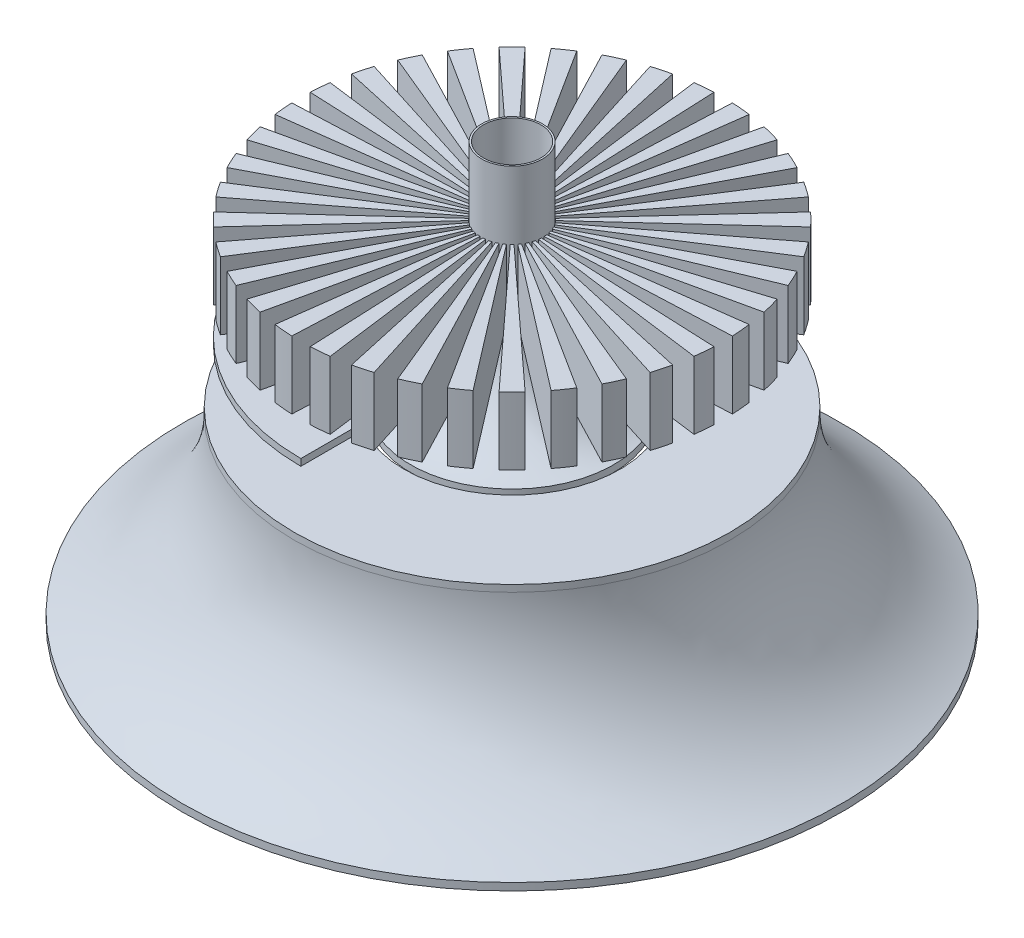
from build123d import *

# Parameters (mm, degrees)
SKETCH_2_R            = 9
SKETCH_2_R_2          = 8.5
EXTRUDE_532_DEPTH     = 40
EXTRUDE_7016_DEPTH    = 20
EXTRUDE_7016_2_DEPTH  = 20
EXTRUDE_7016_3_DEPTH  = 20
EXTRUDE_7016_4_DEPTH  = 20
EXTRUDE_7016_5_DEPTH  = 20
EXTRUDE_7016_6_DEPTH  = 20
EXTRUDE_7016_7_DEPTH  = 20
EXTRUDE_7016_8_DEPTH  = 20
EXTRUDE_7016_9_DEPTH  = 20
EXTRUDE_7016_10_DEPTH = 20
EXTRUDE_7016_11_DEPTH = 20
EXTRUDE_7016_12_DEPTH = 20
EXTRUDE_7016_13_DEPTH = 20
EXTRUDE_7016_14_DEPTH = 20
EXTRUDE_7016_15_DEPTH = 20
EXTRUDE_7016_16_DEPTH = 20
EXTRUDE_7016_17_DEPTH = 20
EXTRUDE_7016_18_DEPTH = 20
EXTRUDE_7016_19_DEPTH = 20
EXTRUDE_7016_20_DEPTH = 20
EXTRUDE_7016_21_DEPTH = 20
EXTRUDE_7016_22_DEPTH = 20
EXTRUDE_7016_23_DEPTH = 20
EXTRUDE_7016_24_DEPTH = 20
EXTRUDE_7016_25_DEPTH = 20
EXTRUDE_7016_26_DEPTH = 20
EXTRUDE_7016_27_DEPTH = 20
EXTRUDE_7016_28_DEPTH = 20
EXTRUDE_7016_29_DEPTH = 20
EXTRUDE_7016_30_DEPTH = 20
EXTRUDE_7016_31_DEPTH = 20
EXTRUDE_7016_32_DEPTH = 20
EXTRUDE_7016_33_DEPTH = 20
EXTRUDE_7016_34_DEPTH = 20
EXTRUDE_7016_35_DEPTH = 20
EXTRUDE_7016_36_DEPTH = 20
EXTRUDE_START         = -10
EXTRUDE_6_DEPTH       = 2
SKETCH_14_R           = 8.5
EXTRUDE_1_DEPTH       = 2
LED_START             = -30
SKETCH_17_R           = 62.5
SKETCH_17_R_2         = 32
LED_DEPTH             = 2
EXTRUDE_START_2       = -30
SKETCH_19_R           = 5
EXTRUDE_5_DEPTH       = 2


with BuildPart() as part:
    # 草图2 → Extrude 532 (new body)
    with BuildSketch(Plane(origin=(0, 0, 0), x_dir=(1, 0, 0), z_dir=(0, 1, 0))):
        Circle(SKETCH_2_R)
        Circle(SKETCH_2_R_2, mode=Mode.SUBTRACT)
    extrude(amount=EXTRUDE_532_DEPTH)



with BuildPart() as body_2:
    # 草图6 → Extrude 7016 (new body)
    with BuildSketch(Plane(origin=(0, 0, 0), x_dir=(1, 0, 0), z_dir=(0, 1, 0))):
        with BuildLine():
            ThreePointArc((-0.396611349, -9.083893359), (-0.792467726, -9.057947562), (-1.186815596, -9.014759446))
            Line((-1.186815596, -9.014759446), (-8.157887014, -61.965303836))
            ThreePointArc((-8.157887014, -61.965303836), (-5.447233922, -62.262168631), (-2.72621171, -62.440513849))
            Line((-2.72621171, -62.440513849), (-0.396611349, -9.083893359))
        make_face()
    extrude(amount=EXTRUDE_7016_DEPTH)


with BuildPart() as body_3:
    # 草图6 → Extrude 7016 2 (new body)
    with BuildSketch(Plane(origin=(0, 0, 0), x_dir=(1, 0, 0), z_dir=(0, 1, 0))):
        with BuildLine():
            ThreePointArc((0.396611349, 9.083893359), (0.792467726, 9.057947562), (1.186815596, 9.014759446))
            Line((1.186815596, 9.014759446), (8.157887014, 61.965303836))
            ThreePointArc((8.157887014, 61.965303836), (5.447233922, 62.262168631), (2.72621171, 62.440513849))
            Line((2.72621171, 62.440513849), (0.396611349, 9.083893359))
        make_face()
    extrude(amount=EXTRUDE_7016_2_DEPTH)


with BuildPart() as body_4:
    # 草图6 → Extrude 7016 3 (new body)
    with BuildSketch(Plane(origin=(0, 0, 0), x_dir=(1, 0, 0), z_dir=(0, 1, 0))):
        with BuildLine():
            Line((13.527475871, 61.018500445), (1.96798746, 8.87701777))
            ThreePointArc((1.96798746, 8.87701777), (2.353324449, 8.782726409), (2.73418175, 8.671716628))
            Line((2.73418175, 8.671716628), (18.794112469, 59.607309422))
            ThreePointArc((18.794112469, 59.607309422), (16.176190319, 60.370364143), (13.527475871, 61.018500445))
        make_face()
    extrude(amount=EXTRUDE_7016_3_DEPTH)


with BuildPart() as body_5:
    # 草图6 → Extrude 7016 4 (new body)
    with BuildSketch(Plane(origin=(0, 0, 0), x_dir=(1, 0, 0), z_dir=(0, 1, 0))):
        with BuildLine():
            Line((23.917714523, 57.742470782), (3.479567267, 8.400418487))
            ThreePointArc((3.479567267, 8.400418487), (3.842676598, 8.240646558), (4.198471176, 8.065188089))
            Line((4.198471176, 8.065188089), (28.859288327, 55.438177074))
            ThreePointArc((28.859288327, 55.438177074), (26.413641359, 56.64423669), (23.917714523, 57.742470782))
        make_face()
    extrude(amount=EXTRUDE_7016_4_DEPTH)


with BuildPart() as body_6:
    # 草图6 → Extrude 7016 5 (new body)
    with BuildSketch(Plane(origin=(0, 0, 0), x_dir=(1, 0, 0), z_dir=(0, 1, 0))):
        with BuildLine():
            Line((33.581225522, 52.711965363), (4.885422184, 7.66857674))
            ThreePointArc((4.885422184, 7.66857674), (5.215270964, 7.448178831), (5.535192179, 7.213602891))
            Line((5.535192179, 7.213602891), (38.047589313, 49.584583768))
            ThreePointArc((38.047589313, 49.584583768), (35.848527272, 51.197002768), (33.581225522, 52.711965363))
        make_face()
    extrude(amount=EXTRUDE_7016_5_DEPTH)


with BuildPart() as body_7:
    # 草图6 → Extrude 7016 6 (new body)
    with BuildSketch(Plane(origin=(0, 0, 0), x_dir=(1, 0, 0), z_dir=(0, 1, 0))):
        with BuildLine():
            Line((59.607309422, 18.794112469), (8.671716628, 2.73418175))
            ThreePointArc((8.671716628, 2.73418175), (8.782726409, 2.353324449), (8.87701777, 1.96798746))
            Line((8.87701777, 1.96798746), (61.018500445, 13.527475871))
            ThreePointArc((61.018500445, 13.527475871), (60.370364143, 16.176190319), (59.607309422, 18.794112469))
        make_face()
    extrude(amount=EXTRUDE_7016_6_DEPTH)


with BuildPart() as body_8:
    # 草图6 → Extrude 7016 7 (new body)
    with BuildSketch(Plane(origin=(0, 0, 0), x_dir=(1, 0, 0), z_dir=(0, 1, 0))):
        with BuildLine():
            Line((42.224387976, 46.079833551), (6.142836019, 6.703729169))
            ThreePointArc((6.142836019, 6.703729169), (6.42940196, 6.42940196), (6.703729169, 6.142836019))
            Line((6.703729169, 6.142836019), (46.079833551, 42.224387976))
            ThreePointArc((46.079833551, 42.224387976), (44.194173824, 44.194173824), (42.224387976, 46.079833551))
        make_face()
    extrude(amount=EXTRUDE_7016_7_DEPTH)


with BuildPart() as body_9:
    # 草图6 → Extrude 7016 8 (new body)
    with BuildSketch(Plane(origin=(0, 0, 0), x_dir=(1, 0, 0), z_dir=(0, 1, 0))):
        with BuildLine():
            Line((49.584583768, 38.047589313), (7.213602891, 5.535192179))
            ThreePointArc((7.213602891, 5.535192179), (7.448178831, 5.215270964), (7.66857674, 4.885422184))
            Line((7.66857674, 4.885422184), (52.711965363, 33.581225522))
            ThreePointArc((52.711965363, 33.581225522), (51.197002768, 35.848527272), (49.584583768, 38.047589313))
        make_face()
    extrude(amount=EXTRUDE_7016_8_DEPTH)


with BuildPart() as body_10:
    # 草图6 → Extrude 7016 9 (new body)
    with BuildSketch(Plane(origin=(0, 0, 0), x_dir=(1, 0, 0), z_dir=(0, 1, 0))):
        with BuildLine():
            Line((55.438177074, 28.859288327), (8.065188089, 4.198471176))
            ThreePointArc((8.065188089, 4.198471176), (8.240646558, 3.842676598), (8.400418487, 3.479567267))
            Line((8.400418487, 3.479567267), (57.742470782, 23.917714523))
            ThreePointArc((57.742470782, 23.917714523), (56.64423669, 26.413641359), (55.438177074, 28.859288327))
        make_face()
    extrude(amount=EXTRUDE_7016_9_DEPTH)


with BuildPart() as body_11:
    # 草图6 → Extrude 7016 10 (new body)
    with BuildSketch(Plane(origin=(0, 0, 0), x_dir=(1, 0, 0), z_dir=(0, 1, 0))):
        with BuildLine():
            Line((61.965303836, 8.157887014), (9.014759446, 1.186815596))
            ThreePointArc((9.014759446, 1.186815596), (9.057947562, 0.792467726), (9.083893359, 0.396611349))
            Line((9.083893359, 0.396611349), (62.440513849, 2.72621171))
            ThreePointArc((62.440513849, 2.72621171), (62.262168631, 5.447233922), (61.965303836, 8.157887014))
        make_face()
    extrude(amount=EXTRUDE_7016_10_DEPTH)


with BuildPart() as body_12:
    # 草图6 → Extrude 7016 11 (new body)
    with BuildSketch(Plane(origin=(0, 0, 0), x_dir=(1, 0, 0), z_dir=(0, 1, 0))):
        with BuildLine():
            Line((-13.527475871, -61.018500445), (-1.96798746, -8.87701777))
            ThreePointArc((-1.96798746, -8.87701777), (-2.353324449, -8.782726409), (-2.73418175, -8.671716628))
            Line((-2.73418175, -8.671716628), (-18.794112469, -59.607309422))
            ThreePointArc((-18.794112469, -59.607309422), (-16.176190319, -60.370364143), (-13.527475871, -61.018500445))
        make_face()
    extrude(amount=EXTRUDE_7016_11_DEPTH)


with BuildPart() as body_13:
    # 草图6 → Extrude 7016 12 (new body)
    with BuildSketch(Plane(origin=(0, 0, 0), x_dir=(1, 0, 0), z_dir=(0, 1, 0))):
        with BuildLine():
            Line((-23.917714523, -57.742470782), (-3.479567267, -8.400418487))
            ThreePointArc((-3.479567267, -8.400418487), (-3.842676598, -8.240646558), (-4.198471176, -8.065188089))
            Line((-4.198471176, -8.065188089), (-28.859288327, -55.438177074))
            ThreePointArc((-28.859288327, -55.438177074), (-26.413641359, -56.64423669), (-23.917714523, -57.742470782))
        make_face()
    extrude(amount=EXTRUDE_7016_12_DEPTH)


with BuildPart() as body_14:
    # 草图6 → Extrude 7016 13 (new body)
    with BuildSketch(Plane(origin=(0, 0, 0), x_dir=(1, 0, 0), z_dir=(0, 1, 0))):
        with BuildLine():
            Line((-33.581225522, -52.711965363), (-4.885422184, -7.66857674))
            ThreePointArc((-4.885422184, -7.66857674), (-5.215270964, -7.448178831), (-5.535192179, -7.213602891))
            Line((-5.535192179, -7.213602891), (-38.047589313, -49.584583768))
            ThreePointArc((-38.047589313, -49.584583768), (-35.848527272, -51.197002768), (-33.581225522, -52.711965363))
        make_face()
    extrude(amount=EXTRUDE_7016_13_DEPTH)


with BuildPart() as body_15:
    # 草图6 → Extrude 7016 14 (new body)
    with BuildSketch(Plane(origin=(0, 0, 0), x_dir=(1, 0, 0), z_dir=(0, 1, 0))):
        with BuildLine():
            Line((-59.607309422, -18.794112469), (-8.671716628, -2.73418175))
            ThreePointArc((-8.671716628, -2.73418175), (-8.782726409, -2.353324449), (-8.87701777, -1.96798746))
            Line((-8.87701777, -1.96798746), (-61.018500445, -13.527475871))
            ThreePointArc((-61.018500445, -13.527475871), (-60.370364143, -16.176190319), (-59.607309422, -18.794112469))
        make_face()
    extrude(amount=EXTRUDE_7016_14_DEPTH)


with BuildPart() as body_16:
    # 草图6 → Extrude 7016 15 (new body)
    with BuildSketch(Plane(origin=(0, 0, 0), x_dir=(1, 0, 0), z_dir=(0, 1, 0))):
        with BuildLine():
            Line((-42.224387976, -46.079833551), (-6.142836019, -6.703729169))
            ThreePointArc((-6.142836019, -6.703729169), (-6.42940196, -6.42940196), (-6.703729169, -6.142836019))
            Line((-6.703729169, -6.142836019), (-46.079833551, -42.224387976))
            ThreePointArc((-46.079833551, -42.224387976), (-44.194173824, -44.194173824), (-42.224387976, -46.079833551))
        make_face()
    extrude(amount=EXTRUDE_7016_15_DEPTH)


with BuildPart() as body_17:
    # 草图6 → Extrude 7016 16 (new body)
    with BuildSketch(Plane(origin=(0, 0, 0), x_dir=(1, 0, 0), z_dir=(0, 1, 0))):
        with BuildLine():
            Line((-49.584583768, -38.047589313), (-7.213602891, -5.535192179))
            ThreePointArc((-7.213602891, -5.535192179), (-7.448178831, -5.215270964), (-7.66857674, -4.885422184))
            Line((-7.66857674, -4.885422184), (-52.711965363, -33.581225522))
            ThreePointArc((-52.711965363, -33.581225522), (-51.197002768, -35.848527272), (-49.584583768, -38.047589313))
        make_face()
    extrude(amount=EXTRUDE_7016_16_DEPTH)


with BuildPart() as body_18:
    # 草图6 → Extrude 7016 17 (new body)
    with BuildSketch(Plane(origin=(0, 0, 0), x_dir=(1, 0, 0), z_dir=(0, 1, 0))):
        with BuildLine():
            Line((-55.438177074, -28.859288327), (-8.065188089, -4.198471176))
            ThreePointArc((-8.065188089, -4.198471176), (-8.240646558, -3.842676598), (-8.400418487, -3.479567267))
            Line((-8.400418487, -3.479567267), (-57.742470782, -23.917714523))
            ThreePointArc((-57.742470782, -23.917714523), (-56.64423669, -26.413641359), (-55.438177074, -28.859288327))
        make_face()
    extrude(amount=EXTRUDE_7016_17_DEPTH)


with BuildPart() as body_19:
    # 草图6 → Extrude 7016 18 (new body)
    with BuildSketch(Plane(origin=(0, 0, 0), x_dir=(1, 0, 0), z_dir=(0, 1, 0))):
        with BuildLine():
            Line((-61.965303836, -8.157887014), (-9.014759446, -1.186815596))
            ThreePointArc((-9.014759446, -1.186815596), (-9.057947562, -0.792467726), (-9.083893359, -0.396611349))
            Line((-9.083893359, -0.396611349), (-62.440513849, -2.72621171))
            ThreePointArc((-62.440513849, -2.72621171), (-62.262168631, -5.447233922), (-61.965303836, -8.157887014))
        make_face()
    extrude(amount=EXTRUDE_7016_18_DEPTH)


with BuildPart() as body_20:
    # 草图6 → Extrude 7016 19 (new body)
    with BuildSketch(Plane(origin=(0, 0, 0), x_dir=(1, 0, 0), z_dir=(0, 1, 0))):
        with BuildLine():
            Line((-62.440513849, 2.72621171), (-9.083893359, 0.396611349))
            ThreePointArc((-9.083893359, 0.396611349), (-9.057947562, 0.792467726), (-9.014759446, 1.186815596))
            Line((-9.014759446, 1.186815596), (-61.965303836, 8.157887014))
            ThreePointArc((-61.965303836, 8.157887014), (-62.262168631, 5.447233922), (-62.440513849, 2.72621171))
        make_face()
    extrude(amount=EXTRUDE_7016_19_DEPTH)


with BuildPart() as body_21:
    # 草图6 → Extrude 7016 20 (new body)
    with BuildSketch(Plane(origin=(0, 0, 0), x_dir=(1, 0, 0), z_dir=(0, 1, 0))):
        with BuildLine():
            Line((-61.018500445, 13.527475871), (-8.87701777, 1.96798746))
            ThreePointArc((-8.87701777, 1.96798746), (-8.782726409, 2.353324449), (-8.671716628, 2.73418175))
            Line((-8.671716628, 2.73418175), (-59.607309422, 18.794112469))
            ThreePointArc((-59.607309422, 18.794112469), (-60.370364143, 16.176190319), (-61.018500445, 13.527475871))
        make_face()
    extrude(amount=EXTRUDE_7016_20_DEPTH)


with BuildPart() as body_22:
    # 草图6 → Extrude 7016 21 (new body)
    with BuildSketch(Plane(origin=(0, 0, 0), x_dir=(1, 0, 0), z_dir=(0, 1, 0))):
        with BuildLine():
            Line((-57.742470782, 23.917714523), (-8.400418487, 3.479567267))
            ThreePointArc((-8.400418487, 3.479567267), (-8.240646558, 3.842676598), (-8.065188089, 4.198471176))
            Line((-8.065188089, 4.198471176), (-55.438177074, 28.859288327))
            ThreePointArc((-55.438177074, 28.859288327), (-56.64423669, 26.413641359), (-57.742470782, 23.917714523))
        make_face()
    extrude(amount=EXTRUDE_7016_21_DEPTH)


with BuildPart() as body_23:
    # 草图6 → Extrude 7016 22 (new body)
    with BuildSketch(Plane(origin=(0, 0, 0), x_dir=(1, 0, 0), z_dir=(0, 1, 0))):
        with BuildLine():
            ThreePointArc((-7.66857674, 4.885422184), (-7.448178831, 5.215270964), (-7.213602891, 5.535192179))
            Line((-7.213602891, 5.535192179), (-49.584583768, 38.047589313))
            ThreePointArc((-49.584583768, 38.047589313), (-51.197002768, 35.848527272), (-52.711965363, 33.581225522))
            Line((-52.711965363, 33.581225522), (-7.66857674, 4.885422184))
        make_face()
    extrude(amount=EXTRUDE_7016_22_DEPTH)


with BuildPart() as body_24:
    # 草图6 → Extrude 7016 23 (new body)
    with BuildSketch(Plane(origin=(0, 0, 0), x_dir=(1, 0, 0), z_dir=(0, 1, 0))):
        with BuildLine():
            Line((-46.079833551, 42.224387976), (-6.703729169, 6.142836019))
            ThreePointArc((-6.703729169, 6.142836019), (-6.42940196, 6.42940196), (-6.142836019, 6.703729169))
            Line((-6.142836019, 6.703729169), (-42.224387976, 46.079833551))
            ThreePointArc((-42.224387976, 46.079833551), (-44.194173824, 44.194173824), (-46.079833551, 42.224387976))
        make_face()
    extrude(amount=EXTRUDE_7016_23_DEPTH)


with BuildPart() as body_25:
    # 草图6 → Extrude 7016 24 (new body)
    with BuildSketch(Plane(origin=(0, 0, 0), x_dir=(1, 0, 0), z_dir=(0, 1, 0))):
        with BuildLine():
            Line((-38.047589313, 49.584583768), (-5.535192179, 7.213602891))
            ThreePointArc((-5.535192179, 7.213602891), (-5.215270964, 7.448178831), (-4.885422184, 7.66857674))
            Line((-4.885422184, 7.66857674), (-33.581225522, 52.711965363))
            ThreePointArc((-33.581225522, 52.711965363), (-35.848527272, 51.197002768), (-38.047589313, 49.584583768))
        make_face()
    extrude(amount=EXTRUDE_7016_24_DEPTH)


with BuildPart() as body_26:
    # 草图6 → Extrude 7016 25 (new body)
    with BuildSketch(Plane(origin=(0, 0, 0), x_dir=(1, 0, 0), z_dir=(0, 1, 0))):
        with BuildLine():
            Line((-28.859288327, 55.438177074), (-4.198471176, 8.065188089))
            ThreePointArc((-4.198471176, 8.065188089), (-3.842676598, 8.240646558), (-3.479567267, 8.400418487))
            Line((-3.479567267, 8.400418487), (-23.917714523, 57.742470782))
            ThreePointArc((-23.917714523, 57.742470782), (-26.413641359, 56.64423669), (-28.859288327, 55.438177074))
        make_face()
    extrude(amount=EXTRUDE_7016_25_DEPTH)


with BuildPart() as body_27:
    # 草图6 → Extrude 7016 26 (new body)
    with BuildSketch(Plane(origin=(0, 0, 0), x_dir=(1, 0, 0), z_dir=(0, 1, 0))):
        with BuildLine():
            Line((-18.794112469, 59.607309422), (-2.73418175, 8.671716628))
            ThreePointArc((-2.73418175, 8.671716628), (-2.353324449, 8.782726409), (-1.96798746, 8.87701777))
            Line((-1.96798746, 8.87701777), (-13.527475871, 61.018500445))
            ThreePointArc((-13.527475871, 61.018500445), (-16.176190319, 60.370364143), (-18.794112469, 59.607309422))
        make_face()
    extrude(amount=EXTRUDE_7016_26_DEPTH)


with BuildPart() as body_28:
    # 草图6 → Extrude 7016 27 (new body)
    with BuildSketch(Plane(origin=(0, 0, 0), x_dir=(1, 0, 0), z_dir=(0, 1, 0))):
        with BuildLine():
            ThreePointArc((-1.186815596, 9.014759446), (-0.792467726, 9.057947562), (-0.396611349, 9.083893359))
            Line((-0.396611349, 9.083893359), (-2.72621171, 62.440513849))
            ThreePointArc((-2.72621171, 62.440513849), (-5.447233922, 62.262168631), (-8.157887014, 61.965303836))
            Line((-8.157887014, 61.965303836), (-1.186815596, 9.014759446))
        make_face()
    extrude(amount=EXTRUDE_7016_27_DEPTH)


with BuildPart() as body_29:
    # 草图6 → Extrude 7016 28 (new body)
    with BuildSketch(Plane(origin=(0, 0, 0), x_dir=(1, 0, 0), z_dir=(0, 1, 0))):
        with BuildLine():
            Line((62.440513849, -2.72621171), (9.083893359, -0.396611349))
            ThreePointArc((9.083893359, -0.396611349), (9.057947562, -0.792467726), (9.014759446, -1.186815596))
            Line((9.014759446, -1.186815596), (61.965303836, -8.157887014))
            ThreePointArc((61.965303836, -8.157887014), (62.262168631, -5.447233922), (62.440513849, -2.72621171))
        make_face()
    extrude(amount=EXTRUDE_7016_28_DEPTH)


with BuildPart() as body_30:
    # 草图6 → Extrude 7016 29 (new body)
    with BuildSketch(Plane(origin=(0, 0, 0), x_dir=(1, 0, 0), z_dir=(0, 1, 0))):
        with BuildLine():
            Line((61.018500445, -13.527475871), (8.87701777, -1.96798746))
            ThreePointArc((8.87701777, -1.96798746), (8.782726409, -2.353324449), (8.671716628, -2.73418175))
            Line((8.671716628, -2.73418175), (59.607309422, -18.794112469))
            ThreePointArc((59.607309422, -18.794112469), (60.370364143, -16.176190319), (61.018500445, -13.527475871))
        make_face()
    extrude(amount=EXTRUDE_7016_29_DEPTH)


with BuildPart() as body_31:
    # 草图6 → Extrude 7016 30 (new body)
    with BuildSketch(Plane(origin=(0, 0, 0), x_dir=(1, 0, 0), z_dir=(0, 1, 0))):
        with BuildLine():
            Line((57.742470782, -23.917714523), (8.400418487, -3.479567267))
            ThreePointArc((8.400418487, -3.479567267), (8.240646558, -3.842676598), (8.065188089, -4.198471176))
            Line((8.065188089, -4.198471176), (55.438177074, -28.859288327))
            ThreePointArc((55.438177074, -28.859288327), (56.64423669, -26.413641359), (57.742470782, -23.917714523))
        make_face()
    extrude(amount=EXTRUDE_7016_30_DEPTH)


with BuildPart() as body_32:
    # 草图6 → Extrude 7016 31 (new body)
    with BuildSketch(Plane(origin=(0, 0, 0), x_dir=(1, 0, 0), z_dir=(0, 1, 0))):
        with BuildLine():
            ThreePointArc((7.66857674, -4.885422184), (7.448178831, -5.215270964), (7.213602891, -5.535192179))
            Line((7.213602891, -5.535192179), (49.584583768, -38.047589313))
            ThreePointArc((49.584583768, -38.047589313), (51.197002768, -35.848527272), (52.711965363, -33.581225522))
            Line((52.711965363, -33.581225522), (7.66857674, -4.885422184))
        make_face()
    extrude(amount=EXTRUDE_7016_31_DEPTH)


with BuildPart() as body_33:
    # 草图6 → Extrude 7016 32 (new body)
    with BuildSketch(Plane(origin=(0, 0, 0), x_dir=(1, 0, 0), z_dir=(0, 1, 0))):
        with BuildLine():
            Line((46.079833551, -42.224387976), (6.703729169, -6.142836019))
            ThreePointArc((6.703729169, -6.142836019), (6.42940196, -6.42940196), (6.142836019, -6.703729169))
            Line((6.142836019, -6.703729169), (42.224387976, -46.079833551))
            ThreePointArc((42.224387976, -46.079833551), (44.194173824, -44.194173824), (46.079833551, -42.224387976))
        make_face()
    extrude(amount=EXTRUDE_7016_32_DEPTH)


with BuildPart() as body_34:
    # 草图6 → Extrude 7016 33 (new body)
    with BuildSketch(Plane(origin=(0, 0, 0), x_dir=(1, 0, 0), z_dir=(0, 1, 0))):
        with BuildLine():
            Line((38.047589313, -49.584583768), (5.535192179, -7.213602891))
            ThreePointArc((5.535192179, -7.213602891), (5.215270964, -7.448178831), (4.885422184, -7.66857674))
            Line((4.885422184, -7.66857674), (33.581225522, -52.711965363))
            ThreePointArc((33.581225522, -52.711965363), (35.848527272, -51.197002768), (38.047589313, -49.584583768))
        make_face()
    extrude(amount=EXTRUDE_7016_33_DEPTH)


with BuildPart() as body_35:
    # 草图6 → Extrude 7016 34 (new body)
    with BuildSketch(Plane(origin=(0, 0, 0), x_dir=(1, 0, 0), z_dir=(0, 1, 0))):
        with BuildLine():
            Line((28.859288327, -55.438177074), (4.198471176, -8.065188089))
            ThreePointArc((4.198471176, -8.065188089), (3.842676598, -8.240646558), (3.479567267, -8.400418487))
            Line((3.479567267, -8.400418487), (23.917714523, -57.742470782))
            ThreePointArc((23.917714523, -57.742470782), (26.413641359, -56.64423669), (28.859288327, -55.438177074))
        make_face()
    extrude(amount=EXTRUDE_7016_34_DEPTH)


with BuildPart() as body_36:
    # 草图6 → Extrude 7016 35 (new body)
    with BuildSketch(Plane(origin=(0, 0, 0), x_dir=(1, 0, 0), z_dir=(0, 1, 0))):
        with BuildLine():
            Line((18.794112469, -59.607309422), (2.73418175, -8.671716628))
            ThreePointArc((2.73418175, -8.671716628), (2.353324449, -8.782726409), (1.96798746, -8.87701777))
            Line((1.96798746, -8.87701777), (13.527475871, -61.018500445))
            ThreePointArc((13.527475871, -61.018500445), (16.176190319, -60.370364143), (18.794112469, -59.607309422))
        make_face()
    extrude(amount=EXTRUDE_7016_35_DEPTH)


with BuildPart() as body_37:
    # 草图6 → Extrude 7016 36 (new body)
    with BuildSketch(Plane(origin=(0, 0, 0), x_dir=(1, 0, 0), z_dir=(0, 1, 0))):
        with BuildLine():
            ThreePointArc((1.186815596, -9.014759446), (0.792467726, -9.057947562), (0.396611349, -9.083893359))
            Line((0.396611349, -9.083893359), (2.72621171, -62.440513849))
            ThreePointArc((2.72621171, -62.440513849), (5.447233922, -62.262168631), (8.157887014, -61.965303836))
            Line((8.157887014, -61.965303836), (1.186815596, -9.014759446))
        make_face()
    extrude(amount=EXTRUDE_7016_36_DEPTH)


with BuildPart() as body_38:
    # 草图21 → 凸台-拉伸6 (new body)
    with BuildSketch(Plane(origin=(0, 0, 0), x_dir=(1, 0, 0), z_dir=(0, 1, 0)).offset(EXTRUDE_START)):
        with BuildLine():
            Line((0, -32), (0, -62.5))
            ThreePointArc((0, -62.5), (-62.5, 0), (0, 62.5))
            Line((0, 62.5), (0, 32))
            ThreePointArc((0, 32), (-32, 0), (0, -32))
        make_face()
    extrude(amount=-EXTRUDE_6_DEPTH)


with BuildPart() as body_39:
    # 草图14 → 凸台-拉伸1 (new body)
    with BuildSketch(Plane(origin=(0, 0, 0), x_dir=(1, 0, 0), z_dir=(0, 1, 0))):
        Circle(SKETCH_14_R)
    extrude(amount=-EXTRUDE_1_DEPTH)


with BuildPart() as part_1:
    add(part.part)

    add(body_39.part)  # Revolve 8676 merges body 39
    # 草图16 → Revolve 8676 (revolve)
    with BuildSketch(Plane.XY):
        with BuildLine():
            Line((0, 0), (0, -29.866613912))
            Line((0, -29.866613912), (30, -29.866613912))
            Line((30, -29.866613912), (30, -27.866613912))
            ThreePointArc((30, -27.866613912), (14.837803364, -17.446691455), (9, 0))
            Line((9, 0), (0, 0))
        make_face()
    revolve(axis=Axis((0, 0, 0), (0, 1, 0)))


with BuildPart() as body_39_2:
    # 草图17 → LED面板 (new body)
    with BuildSketch(Plane(origin=(0, 0, 0), x_dir=(1, 0, 0), z_dir=(0, 1, 0)).offset(LED_START)):
        Circle(SKETCH_17_R)
        Circle(SKETCH_17_R_2, mode=Mode.SUBTRACT)
    extrude(amount=LED_DEPTH)

    # 草图19 → 凸台-拉伸5 (add)
    with BuildSketch(Plane(origin=(0, 0, 0), x_dir=(1, 0, 0), z_dir=(0, 1, 0)).offset(EXTRUDE_START_2)):
        with Locations((17.986121321, -43.422338028)):
            Circle(SKETCH_19_R)
        with Locations((41.689509159, -21.702184822)):
            Circle(SKETCH_19_R)
        with Locations((-41.689509159, -21.702184822)):
            Circle(SKETCH_19_R)
        with Locations((-17.986121321, -43.422338028)):
            Circle(SKETCH_19_R)
        with Locations((-41.689509159, 21.702184822)):
            Circle(SKETCH_19_R)
        with Locations((-17.986121321, 43.422338028)):
            Circle(SKETCH_19_R)
        with Locations((17.986121321, 43.422338028)):
            Circle(SKETCH_19_R)
        with Locations((41.689509159, 21.702184822)):
            Circle(SKETCH_19_R)
    extrude(amount=-EXTRUDE_5_DEPTH)

    # 草图23 → 旋转1 (revolve)
    with BuildSketch(Plane.XY):
        with BuildLine():
            Line((64.403862136, -30), (64.403862136, -28))
            Line((64.403862136, -28), (62.403862136, -28))
            Line((62.403862136, -28), (62.403862136, -30))
            ThreePointArc((62.403862136, -30), (71.970028116, -61.829915823), (97.498615296, -83.112451137))
            Line((97.498615296, -83.112451137), (97.498615296, -80.931149956))
            ThreePointArc((97.498615296, -80.931149956), (73.404228502, -60.369576563), (64.403862136, -30))
        make_face()
    revolve(axis=Axis((0, 0, 0), (0, -1, 0)))


solid = Compound([body_2.part, body_3.part, body_4.part, body_5.part, body_6.part, body_7.part, body_8.part, body_9.part, body_10.part, body_11.part, body_12.part, body_13.part, body_14.part, body_15.part, body_16.part, body_17.part, body_18.part, body_19.part, body_20.part, body_21.part, body_22.part, body_23.part, body_24.part, body_25.part, body_26.part, body_27.part, body_28.part, body_29.part, body_30.part, body_31.part, body_32.part, body_33.part, body_34.part, body_35.part, body_36.part, body_37.part, body_38.part, part_1.part, body_39_2.part])
